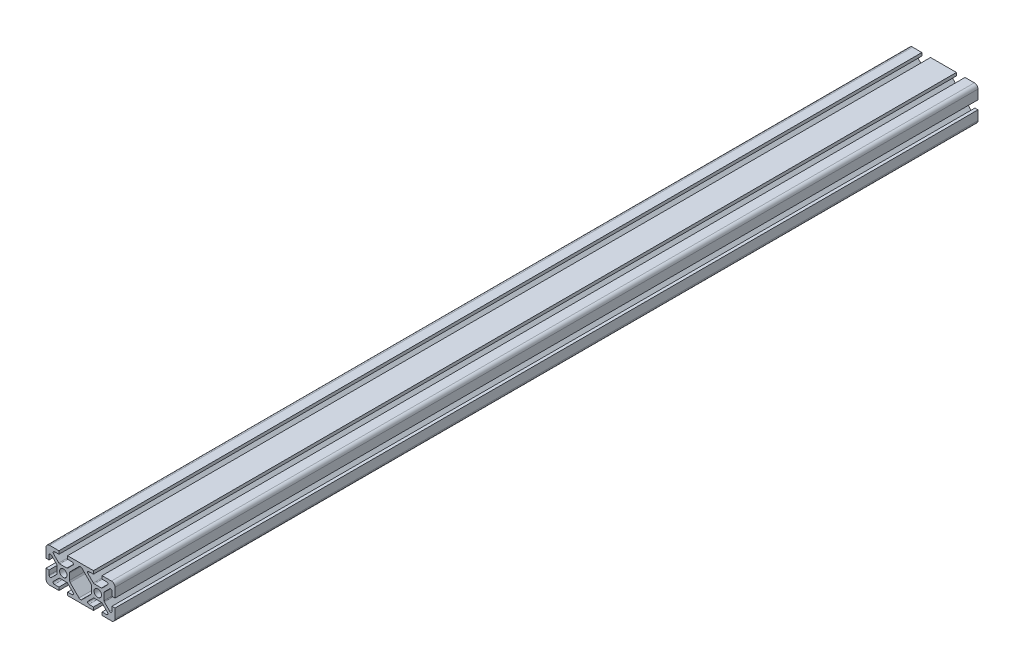
from build123d import *

# Parameters (mm, degrees)
BOSS_EXTRUDE1_DEPTH = 250
BOSS_EXTRUDE2_DEPTH = 250
FILLET1_R           = 0.75
FILLET2_R           = 1.25


with BuildPart() as part:
    # Sketch3 → Boss-Extrude1 (new, symmetric)
    with BuildSketch(Plane.XY):
        with BuildLine():
            Line((12.5, -10), (17.9, -10))
            ThreePointArc((17.9, -10), (19.38492424, -9.38492424), (20, -7.9))
            Line((20, -7.9), (20, -2.5))
            Line((20, -2.5), (18.213351365, -2.5))
            Line((18.213351365, -2.5), (18.213351365, -6.95))
            Line((18.213351365, -6.95), (13.6, -2.336648635))
            Line((13.6, -2.336648635), (13.6, 0))
            Line((13.6, 0), (12.15, 0))
            ThreePointArc((12.15, 0), (11.52027958, -1.52027958), (10, -2.15))
            Line((10, -2.15), (10, -3.6))
            Line((10, -3.6), (12.336648635, -3.6))
            Line((12.336648635, -3.6), (16.95, -8.213351365))
            Line((16.95, -8.213351365), (12.5, -8.213351365))
            Line((12.5, -8.213351365), (12.5, -10))
        make_face()
    extrude(amount=BOSS_EXTRUDE1_DEPTH, both=True)

    # Sketch4 → Boss-Extrude2 (add, symmetric)
    with BuildSketch(Plane.XY):
        with BuildLine():
            Line((10, -3.6), (7.663351365, -3.6))
            Line((7.663351365, -3.6), (3.05, -8.213351365))
            Line((3.05, -8.213351365), (7.5, -8.213351365))
            Line((7.5, -8.213351365), (7.5, -10))
            Line((7.5, -10), (0, -10))
            Line((0, -10), (0, -8.736648635))
            Line((0, -8.736648635), (6.4, -2.336648635))
            Line((6.4, -2.336648635), (6.4, 0))
            Line((6.4, 0), (7.85, 0))
            ThreePointArc((7.85, 0), (8.47972042, -1.52027958), (10, -2.15))
            Line((10, -2.15), (10, -3.6))
        make_face()
    extrude(amount=BOSS_EXTRUDE2_DEPTH, both=True)

    # Mirror1: part across plane


with BuildPart() as part_1:
    add(part.part)
    add(part.part.mirror(Plane(origin=(0, 0, 0), x_dir=(0, 0, 1), z_dir=(1, 0, 0))))

    # Mirror2: part across plane


with BuildPart() as part_2:
    add(part_1.part)
    add(part_1.part.mirror(Plane.ZX))

    # Fillet1
    fillet1_edges = [part_2.edges().sort_by_distance(p)[0] for p in [
        (18.213351365, 6.95, 0),
        (13.6, 2.336648635, 0),
        (12.336648635, 3.6, 0),
        (16.95, 8.213351365, 0),
        (3.05, 8.213351365, 0),
        (7.663351365, 3.6, 0),
        (-18.213351365, 6.95, 0),
        (-13.6, 2.336648635, 0),
        (-7.663351365, 3.6, 0),
        (-12.336648635, 3.6, 0),
        (-16.95, 8.213351365, 0),
        (-3.05, 8.213351365, 0),
        (16.95, -8.213351365, 0),
        (12.336648635, -3.6, 0),
        (13.6, -2.336648635, 0),
        (18.213351365, -6.95, 0),
        (3.05, -8.213351365, 0),
        (7.663351365, -3.6, 0),
        (-18.213351365, -6.95, 0),
        (-13.6, -2.336648635, 0),
        (-12.336648635, -3.6, 0),
        (-16.95, -8.213351365, 0),
        (-3.05, -8.213351365, 0),
        (-7.663351365, -3.6, 0),
    ]]
    fillet(fillet1_edges, radius=FILLET1_R)

    # Fillet2
    fillet2_edges = [part_2.edges().sort_by_distance(p)[0] for p in [
        (6.4, 2.336648635, 0),
        (0, 8.736648635, 0),
        (-6.4, 2.336648635, 0),
        (6.4, -2.336648635, 0),
        (-6.4, -2.336648635, 0),
        (0, -8.736648635, 0),
    ]]
    fillet(fillet2_edges, radius=FILLET2_R)


solid = part_2.part
